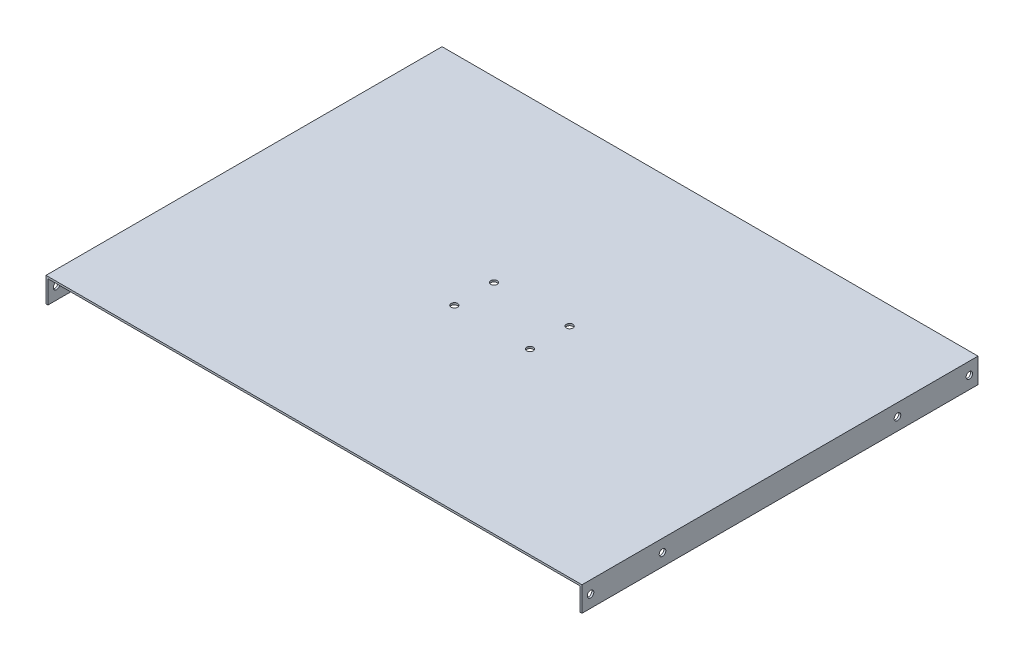
from build123d import *

# Parameters (mm, degrees)
ESBO_O1_W                  = 324.8
ESBO_O1_H                  = 240
RESSALTO_EXTRUS_O1_DEPTH   = 15
ESBO_O2_W                  = 322.4
ESBO_O2_H                  = 240
CORTE_EXTRUS_O1_DEPTH      = 13.8
CORTE_EXTRUS_O2_START      = 10
ESBO_O3_R                  = 2
CORTE_EXTRUS_O2_DEPTH      = 13.8
CORTE_EXTRUS_O3_DEPTH      = 170
CORTE_EXTRUS_O3_DEPTH_BACK = 170
ESBO_O4_R                  = 2


with BuildPart() as part:
    # Esboço1 → Ressalto-extrusão1 (new body)
    with BuildSketch(Plane(origin=(0, 0, 0), x_dir=(1, 0, 0), z_dir=(0, 1, 0))):
        Rectangle(ESBO_O1_W, ESBO_O1_H)
    extrude(amount=RESSALTO_EXTRUS_O1_DEPTH)

    # Esboço2 → Corte-extrusão1 (cut)
    with BuildSketch(Plane(origin=(0, 0, 0), x_dir=(1, 0, 0), z_dir=(0, 1, 0))):
        Rectangle(ESBO_O2_W, ESBO_O2_H)
    extrude(amount=CORTE_EXTRUS_O1_DEPTH, mode=Mode.SUBTRACT)

    # Esboço3 → Corte-extrusão2 (cut)
    with BuildSketch(Plane(origin=(0, 0, 0), x_dir=(1, 0, 0), z_dir=(0, 1, 0)).offset(CORTE_EXTRUS_O2_START)):
        with Locations(Location((-22.92, -12, 0), (0, 0, 90))):
            Circle(ESBO_O3_R)
        with Locations(Location((22.92, -12, 0), (0, 0, 90))):
            Circle(ESBO_O3_R)
        with Locations(Location((22.92, 12, 0), (0, 0, 90))):
            Circle(ESBO_O3_R)
        with Locations(Location((-22.92, 12, 0), (0, 0, 90))):
            Circle(ESBO_O3_R)
    extrude(amount=CORTE_EXTRUS_O2_DEPTH, mode=Mode.SUBTRACT)

    # Esboço4 → Corte-extrusão3 (cut, two sides: drawn at the far end of the back side and taken through both)
    with BuildSketch(Plane(origin=(0, 0, 0), x_dir=(0, 0, -1), z_dir=(1, 0, 0)).offset(-CORTE_EXTRUS_O3_DEPTH_BACK)):
        with Locations((114.8, 7.5)):
            Circle(ESBO_O4_R)
        with Locations((71.2, 7.5)):
            Circle(ESBO_O4_R)
        with Locations((-114.8, 7.5)):
            Circle(ESBO_O4_R)
        with Locations((-71.2, 7.5)):
            Circle(ESBO_O4_R)
    extrude(amount=CORTE_EXTRUS_O3_DEPTH + CORTE_EXTRUS_O3_DEPTH_BACK, mode=Mode.SUBTRACT)


solid = part.part
